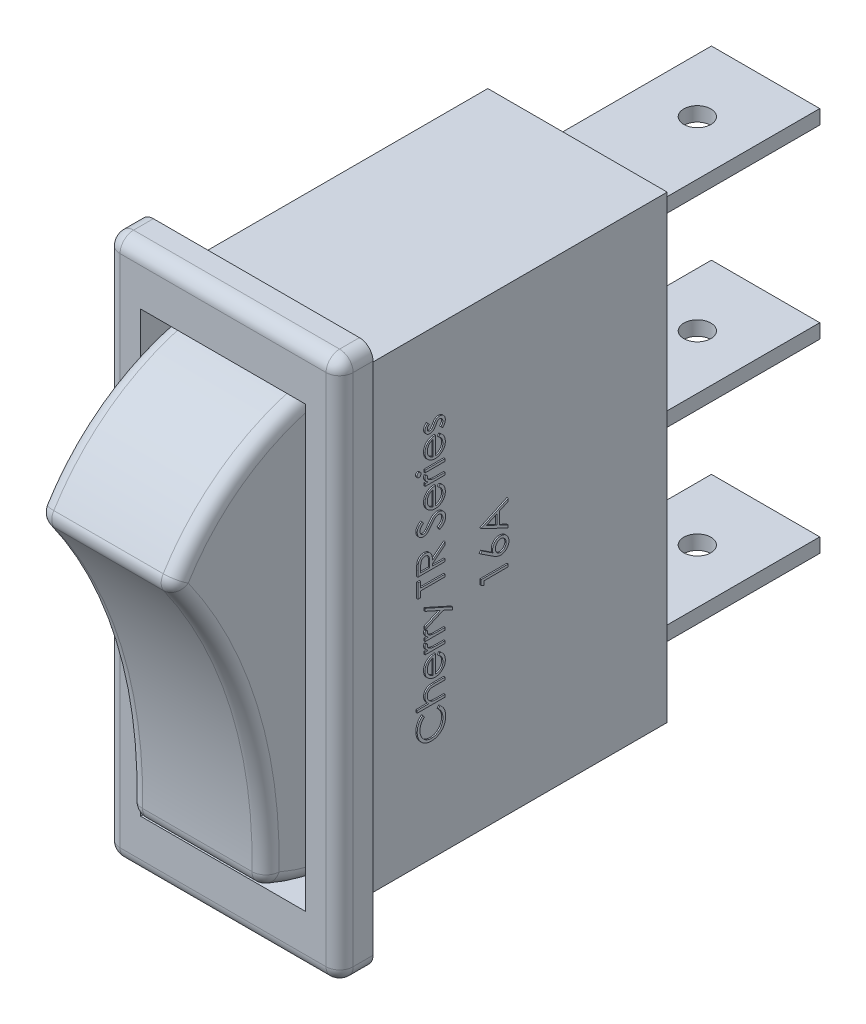
from build123d import *

# Parameters (mm, degrees)
SKETCH1_W                     = 10.5156
SKETCH1_H                     = 26.924
MAIN_BODY_DEPTH               = 18.8214
SKETCH2_W                     = 8.9281
SKETCH2_H                     = 25.3365
MAIN_BODY_LIGHT_DEPTH         = 17.4625
SKETCH3_W                     = 13.6652
SKETCH3_H                     = 31.75
SKETCH3_W_2                   = 9.6652
SKETCH3_H_2                   = 25.75
FLANGE_DEPTH                  = 1.9558
SKETCH4_R                     = 1.5875
SWITCH_BODY_AND_PROFILE_DEPTH = 4
FILLET1_R                     = 0.79375
FILLET2_R                     = 0.79375
SKETCH5_W                     = 6.35
SKETCH5_H                     = 0.8382
EXTRUDE5_DEPTH                = 11.0236
SKETCH6_W                     = 0.79375
SKETCH6_H                     = 27.0256
SKETCH8_W                     = 1.160096154
SKETCH8_H                     = 0.142467949
LABEL_TEXT_DEPTH              = 0.0762


with BuildPart() as part:
    # Sketch1 → main body (new body)
    with BuildSketch(Plane.XY):
        Rectangle(SKETCH1_W, SKETCH1_H)
    extrude(amount=-MAIN_BODY_DEPTH)

    # Sketch2 → main body light (cut)
    with BuildSketch(Plane.XY):
        Rectangle(SKETCH2_W, SKETCH2_H)
    extrude(amount=-MAIN_BODY_LIGHT_DEPTH, mode=Mode.SUBTRACT)

    # Sketch3 → flange (add)
    with BuildSketch(Plane.XY):
        Rectangle(SKETCH3_W, SKETCH3_H)
        Rectangle(SKETCH3_W_2, SKETCH3_H_2, mode=Mode.SUBTRACT)
    extrude(amount=FLANGE_DEPTH)

    # Fillet1
    fillet1_edges = [part.edges().sort_by_distance(p)[0] for p in [
        (-6.8326, 0, 1.9558),
        (0, -15.875, 1.9558),
        (6.8326, 0, 1.9558),
        (0, 15.875, 1.9558),
        (-6.8326, 15.875, 0.9779),
        (-6.8326, -15.875, 0.9779),
        (6.8326, -15.875, 0.9779),
        (6.8326, 15.875, 0.9779),
    ]]
    fillet(fillet1_edges, radius=FILLET1_R)

    # Sketch5 → Extrude5 (add)
    with BuildSketch(Plane(origin=(0, 0, -18.8214), x_dir=(-1, 0, 0), z_dir=(0, 0, -1))):
        with Locations((0, -11.0109)):
            Rectangle(SKETCH5_W, SKETCH5_H)
        with Locations((0, -0.1397)):
            Rectangle(SKETCH5_W, SKETCH5_H)
        with Locations((0, 10.7315)):
            Rectangle(SKETCH5_W, SKETCH5_H)
    extrude(amount=EXTRUDE5_DEPTH)

    # Sketch6 → 1/16 (0.0625) Diameter Hole1 (revolve, cut)
    with BuildSketch(Plane(origin=(0, 11.1506, -25.845), x_dir=(0, 0, 1), z_dir=(1, 0, 0))):
        with Locations((0.396875, 13.5128)):
            Rectangle(SKETCH6_W, SKETCH6_H)
    revolve(axis=Axis((0, 17.5006, -25.845), (0, -1, 0)), mode=Mode.SUBTRACT)

    # Sketch8 → label text (add)
    # profile 1 of 18: a face of its own
    with BuildSketch(Plane(origin=(5.2578, 0, 0), x_dir=(0, 0, -1), z_dir=(1, 0, 0))):
        with BuildLine():
            Line((4.422176487, -5.869723925), (4.517579131, -5.99438338))
            add(Edge.make_bspline(
                [(4.517579131, -5.99438338), (4.506981135, -6.003276142), (4.485928026, -6.020941772), (4.456362387, -6.049360856), (4.428672635, -6.078984828), (4.40268086, -6.109772468), (4.379431725, -6.142436275), (4.357114567, -6.175731665), (4.337575128, -6.210868407), (4.313705258, -6.259209081), (4.289340153, -6.322693504), (4.268384059, -6.402333772), (4.255169629, -6.485584911), (4.253728708, -6.542368795), (4.252995797, -6.571251369)],
                knots=[0, 0, 0, 0, 0.75789156, 1.505565099, 2.245254514, 2.979266606, 3.711207489, 4.440978832, 5.174393176, 5.91211879, 7.394186119, 8.890401545, 10.418332761, 12, 12, 12, 12], degree=3))
            add(Edge.make_bspline(
                [(4.252995797, -6.571251369), (4.253179023, -6.587164151), (4.253543774, -6.61884203), (4.258355771, -6.665854016), (4.265119069, -6.71198815), (4.275154484, -6.757214422), (4.287842064, -6.801475264), (4.303002879, -6.845060031), (4.321760247, -6.887337703), (4.342492228, -6.92889309), (4.365908886, -6.968707335), (4.39145129, -7.006378359), (4.418831979, -7.041770973), (4.448159575, -7.074905103), (4.479279951, -7.10584434), (4.512541759, -7.13419936), (4.547589419, -7.160349007), (4.584452037, -7.18414425), (4.622786294, -7.205565494), (4.662811057, -7.223577429), (4.703841019, -7.239308932), (4.746167055, -7.251952977), (4.789507843, -7.261883214), (4.834042933, -7.268748522), (4.879687888, -7.273504751), (4.91062563, -7.27386783), (4.926220457, -7.274050848)],
                knots=[0, 0, 0, 0, 1.054877232, 2.099964208, 3.13098259, 4.145888998, 5.169474743, 6.183358035, 7.203388855, 8.234598956, 9.261847606, 10.264062591, 11.251197969, 12.227332808, 13.196685059, 14.158975844, 15.123498106, 16.094582253, 17.066912473, 18.032714859, 19.002806091, 19.979168736, 20.95977404, 21.949109834, 22.966205168, 24, 24, 24, 24], degree=3))
            add(Edge.make_bspline(
                [(4.926220457, -7.274050848), (4.949683783, -7.273477181), (4.99575091, -7.272350862), (5.063236434, -7.262369418), (5.127949673, -7.247079802), (5.18945246, -7.224540004), (5.248257497, -7.196192633), (5.30365165, -7.16082293), (5.356446461, -7.119703576), (5.40536327, -7.072412738), (5.450045649, -7.020520156), (5.489393402, -6.964845574), (5.522193322, -6.905525462), (5.549487424, -6.843215373), (5.570468151, -6.777435664), (5.585238308, -6.708304667), (5.594873154, -6.635972725), (5.595795577, -6.586547319), (5.596265028, -6.561393096)],
                knots=[0, 0, 0, 0, 1.029159485, 2.020618137, 2.987588728, 3.942669054, 4.889339625, 5.846988364, 6.821327795, 7.821533711, 8.827683044, 9.822769455, 10.807800696, 11.797391277, 12.803701919, 13.832062008, 14.896664671, 16, 16, 16, 16], degree=3))
            add(Edge.make_bspline(
                [(5.596265028, -6.561393096), (5.595499046, -6.533678662), (5.59399141, -6.479130026), (5.581219179, -6.399134528), (5.560510052, -6.322555449), (5.53152778, -6.249388668), (5.493851739, -6.179840454), (5.448178058, -6.113801969), (5.394072279, -6.051217471), (5.352759574, -6.013584068), (5.331681695, -5.99438338)],
                knots=[0, 0, 0, 0, 1.028121516, 2.023589091, 2.998037872, 3.967518031, 4.937445131, 5.927275754, 6.942489185, 8, 8, 8, 8], degree=3))
            Line((5.331681695, -5.99438338), (5.426130313, -5.869723925))
            add(Edge.make_bspline(
                [(5.426130313, -5.869723925), (5.439074091, -5.879756419), (5.464899648, -5.899773353), (5.501315246, -5.932179451), (5.5355369, -5.966342572), (5.567393707, -6.002350529), (5.597017528, -6.040266789), (5.624424456, -6.080087872), (5.649469041, -6.121779787), (5.672473722, -6.165011381), (5.692728564, -6.209882271), (5.710677312, -6.25599744), (5.725536893, -6.30363964), (5.738106432, -6.352407827), (5.747069078, -6.402742449), (5.754206228, -6.454058402), (5.758440513, -6.506835987), (5.758868603, -6.542411086), (5.759085541, -6.560439069)],
                knots=[0, 0, 0, 0, 0.986911346, 1.969095443, 2.935967484, 3.900112155, 4.865124501, 5.834589912, 6.812044781, 7.795288262, 8.784678562, 9.777857908, 10.776141921, 11.791195789, 12.811324908, 13.855933174, 14.913475973, 16, 16, 16, 16], degree=3))
            add(Edge.make_bspline(
                [(5.759085541, -6.560439069), (5.758966709, -6.577513161), (5.758731732, -6.611275063), (5.754925285, -6.661121997), (5.749732012, -6.709649414), (5.741912381, -6.756718619), (5.732684769, -6.802586472), (5.720315306, -6.846837166), (5.706459077, -6.889906136), (5.690173601, -6.931620348), (5.671796618, -6.972015283), (5.651026876, -7.010960655), (5.62803903, -7.048438551), (5.603339793, -7.084817438), (5.576135803, -7.119559914), (5.546804865, -7.152967049), (5.515445838, -7.185226172), (5.492833101, -7.205184532), (5.481463846, -7.215219217)],
                knots=[0, 0, 0, 0, 1.114604814, 2.203992996, 3.262667896, 4.300477797, 5.318619304, 6.316056647, 7.298880507, 8.271930387, 9.238335007, 10.195173496, 11.151986948, 12.108099108, 13.064862484, 14.031167946, 15.010108607, 16, 16, 16, 16], degree=3))
            add(Edge.make_bspline(
                [(5.481463846, -7.215219217), (5.4617144, -7.231290765), (5.422453939, -7.263239829), (5.358830225, -7.304133699), (5.292460828, -7.33902192), (5.222961326, -7.367545221), (5.150304702, -7.389454444), (5.074607837, -7.404858051), (4.996022055, -7.414797976), (4.942575408, -7.415938872), (4.915408157, -7.416518797)],
                knots=[0, 0, 0, 0, 0.994611881, 1.977215934, 2.950189954, 3.921972279, 4.908960509, 5.911694611, 6.938501887, 8, 8, 8, 8], degree=3))
            add(Edge.make_bspline(
                [(4.915408157, -7.416518797), (4.886853362, -7.415813405), (4.830673586, -7.414425592), (4.748226114, -7.402634642), (4.669236015, -7.383666831), (4.593850745, -7.356726099), (4.521673797, -7.322569743), (4.453256536, -7.280375529), (4.388161416, -7.230633647), (4.327376154, -7.173734214), (4.271795805, -7.111337602), (4.222897991, -7.044517997), (4.182204689, -6.973406185), (4.148188573, -6.898785588), (4.122042691, -6.82009744), (4.103739639, -6.737509626), (4.092347232, -6.651177332), (4.090907049, -6.592275446), (4.090175285, -6.562347122)],
                knots=[0, 0, 0, 0, 1.032925535, 2.032216505, 3.007276963, 3.968222605, 4.92396291, 5.891752235, 6.871517503, 7.883894988, 8.900124299, 9.891468569, 10.874487609, 11.85992873, 12.854644235, 13.869047385, 14.917252991, 16, 16, 16, 16], degree=3))
            add(Edge.make_bspline(
                [(4.090175285, -6.562347122), (4.090394159, -6.544107046), (4.090827399, -6.508002654), (4.095045642, -6.454592548), (4.102092306, -6.402597252), (4.111633025, -6.351962083), (4.123647637, -6.302540651), (4.138621692, -6.254425415), (4.156449356, -6.207734198), (4.176807722, -6.162482168), (4.199700589, -6.1189748), (4.224857927, -6.077239409), (4.252152624, -6.037442382), (4.281864116, -5.999790567), (4.313745948, -5.964237897), (4.347424671, -5.930256982), (4.383764505, -5.898836974), (4.409349054, -5.879446039), (4.422176487, -5.869723925)],
                knots=[0, 0, 0, 0, 1.096622143, 2.170653093, 3.219033441, 4.250379162, 5.267604342, 6.275621678, 7.278284436, 8.271072515, 9.257558938, 10.232633088, 11.19973724, 12.157384997, 13.114417402, 14.069920322, 15.032307892, 16, 16, 16, 16], degree=3))
        make_face()
    # profile 2 of 18: a face of its own
    with BuildSketch(Plane(origin=(5.2578, 0, 0), x_dir=(0, 0, -1), z_dir=(1, 0, 0))):
        with BuildLine():
            Line((4.090175285, -5.584788027), (4.090175285, -5.442320079))
            Line((4.090175285, -5.442320079), (4.777392332, -5.442320079))
            add(Edge.make_bspline(
                [(4.777392332, -5.442320079), (4.758279168, -5.427025474), (4.72106486, -5.397246095), (4.672475427, -5.347147511), (4.630453596, -5.29556879), (4.596558126, -5.241161974), (4.570042565, -5.184401842), (4.551753667, -5.125206975), (4.540091931, -5.06381617), (4.538658066, -5.022071151), (4.537931695, -5.000923845)],
                knots=[0, 0, 0, 0, 1.125633083, 2.191665293, 3.205031882, 4.182434329, 5.134135993, 6.080017564, 7.027370072, 8, 8, 8, 8], degree=3))
            add(Edge.make_bspline(
                [(4.537931695, -5.000923845), (4.538677365, -4.979445194), (4.540137554, -4.937385221), (4.553040811, -4.876376371), (4.573341322, -4.81904747), (4.602165325, -4.766242756), (4.637763705, -4.718531561), (4.679292289, -4.676771395), (4.726757026, -4.64203445), (4.770864403, -4.618759634), (4.81010573, -4.603518873), (4.843779682, -4.593882663), (4.881299248, -4.58570875), (4.92264919, -4.578588081), (4.968026753, -4.573842013), (5.017227596, -4.570029944), (5.070248783, -4.567319188), (5.106951897, -4.56721414), (5.125929992, -4.567159822)],
                knots=[0, 0, 0, 0, 1.235771509, 2.41991536, 3.57472251, 4.727526861, 5.870395018, 6.992794988, 8.106410512, 9.245194824, 9.854018721, 10.52826073, 11.259975989, 12.064917182, 12.943387139, 13.886414983, 14.90712766, 16, 16, 16, 16], degree=3))
            Line((5.125929992, -4.567159822), (5.718380413, -4.567159822))
            Line((5.718380413, -4.567159822), (5.718380413, -4.709627771))
            Line((5.718380413, -4.709627771), (5.172677288, -4.709627771))
            add(Edge.make_bspline(
                [(5.172677288, -4.709627771), (5.1568827, -4.709713742), (5.12667034, -4.70987819), (5.083415262, -4.710428471), (5.044288033, -4.711628933), (5.009207432, -4.71364054), (4.978221, -4.715664688), (4.951278125, -4.7185344), (4.928547828, -4.721848325), (4.914866027, -4.724827928), (4.908729972, -4.726164229)],
                knots=[0, 0, 0, 0, 1.430934443, 2.737134061, 3.918973087, 4.976914145, 5.92044225, 6.731742364, 7.431207999, 8, 8, 8, 8], degree=3))
            add(Edge.make_bspline(
                [(4.908729972, -4.726164229), (4.890712642, -4.731321909), (4.856165941, -4.741211323), (4.809321781, -4.764656187), (4.76902409, -4.793258823), (4.736398166, -4.828705845), (4.710797833, -4.869760529), (4.693081668, -4.916874096), (4.682082467, -4.969570221), (4.680976233, -5.00669595), (4.680399644, -5.026046541)],
                knots=[0, 0, 0, 0, 1.090133324, 2.090238182, 3.036763777, 3.954757083, 4.878717367, 5.838952881, 6.873623762, 8, 8, 8, 8], degree=3))
            add(Edge.make_bspline(
                [(4.680399644, -5.026046541), (4.680612358, -5.0375083), (4.681033315, -5.060190825), (4.685366631, -5.093807683), (4.69221052, -5.12651887), (4.702319554, -5.158236588), (4.714610227, -5.189025538), (4.729693342, -5.219010873), (4.747930451, -5.247782226), (4.768456136, -5.275710951), (4.79116297, -5.301709848), (4.815133713, -5.325897167), (4.8406582, -5.347459288), (4.867328313, -5.366993947), (4.895509504, -5.383856961), (4.92493011, -5.398576751), (4.955628796, -5.411066156), (4.976935342, -5.417272234), (4.987596158, -5.420377471)],
                knots=[0, 0, 0, 0, 1.024369801, 2.02720137, 3.025498567, 4.008789058, 4.999724648, 5.987391013, 7.005161842, 8.042127274, 9.083588116, 10.088924978, 11.084112559, 12.068088063, 13.041783903, 14.016724555, 15.007660144, 16, 16, 16, 16], degree=3))
            add(Edge.make_bspline(
                [(4.987596158, -5.420377471), (4.995316375, -5.422164282), (5.012139678, -5.426057965), (5.039886604, -5.430282907), (5.072129351, -5.434064693), (5.108819016, -5.437261714), (5.150090044, -5.439222543), (5.1956608, -5.441335387), (5.245816738, -5.442121887), (5.280694343, -5.44225204), (5.298926787, -5.442320079)],
                knots=[0, 0, 0, 0, 0.607992626, 1.324890765, 2.152360218, 3.099583803, 4.150613268, 5.323148443, 6.60066238, 8, 8, 8, 8], degree=3))
            Line((5.298926787, -5.442320079), (5.718380413, -5.442320079))
            Line((5.718380413, -5.442320079), (5.718380413, -5.584788027))
            Line((5.718380413, -5.584788027), (4.090175285, -5.584788027))
        make_face()
    # profile 3 of 18: a face of its own
    with BuildSketch(Plane(origin=(5.2578, 0, 0), x_dir=(0, 0, -1), z_dir=(1, 0, 0))):
        with BuildLine():
            Line((5.352034259, -3.289400407), (5.418498101, -3.162832899))
            add(Edge.make_bspline(
                [(5.418498101, -3.162832899), (5.436384228, -3.172924075), (5.471183549, -3.192557506), (5.518996313, -3.226183896), (5.561753374, -3.261756808), (5.598770066, -3.300358584), (5.631460403, -3.34082599), (5.659657646, -3.383927626), (5.683870576, -3.429311682), (5.703710813, -3.47747804), (5.719308353, -3.528369), (5.730827244, -3.58227987), (5.737507105, -3.639465195), (5.73831784, -3.678625628), (5.738732977, -3.698677751)],
                knots=[0, 0, 0, 0, 1.120611642, 2.180266485, 3.186550691, 4.152466804, 5.095166165, 6.022949561, 6.960161436, 7.899497276, 8.862391909, 9.862399089, 10.905440174, 12, 12, 12, 12], degree=3))
            add(Edge.make_bspline(
                [(5.738732977, -3.698677751), (5.738212651, -3.720967148), (5.737197646, -3.764447304), (5.728447135, -3.827738547), (5.714172172, -3.887328496), (5.694230661, -3.943213811), (5.668183258, -3.995257594), (5.636451672, -4.043563428), (5.599198692, -4.088384805), (5.556102464, -4.128311348), (5.509980517, -4.164249371), (5.461928883, -4.195982852), (5.412113972, -4.222389658), (5.360832171, -4.24419827), (5.308200013, -4.261401132), (5.253916067, -4.273625751), (5.198195584, -4.280607644), (5.16050579, -4.281682342), (5.141512424, -4.282223925)],
                knots=[0, 0, 0, 0, 1.14524686, 2.234044844, 3.276713788, 4.290115724, 5.276966211, 6.260758605, 7.254862358, 8.264742877, 9.274005885, 10.257798278, 11.220590477, 12.167824544, 13.118936889, 14.062732937, 15.023735098, 16, 16, 16, 16], degree=3))
            add(Edge.make_bspline(
                [(5.141512424, -4.282223925), (5.123689412, -4.281743529), (5.088366555, -4.280791447), (5.036085397, -4.27479034), (4.985272492, -4.264154864), (4.935885617, -4.249560603), (4.888007464, -4.230714145), (4.841608892, -4.207658102), (4.796739275, -4.180356559), (4.768434996, -4.159277882), (4.754177688, -4.148660223)],
                knots=[0, 0, 0, 0, 1.024358464, 2.0301432, 3.019427413, 4.004406732, 4.986367066, 5.972626655, 6.978780325, 8, 8, 8, 8], degree=3))
            add(Edge.make_bspline(
                [(4.754177688, -4.148660223), (4.736972972, -4.134303318), (4.703163804, -4.106090414), (4.659144777, -4.057877241), (4.621490262, -4.006374305), (4.590771635, -3.951063549), (4.567144153, -3.89203814), (4.550338238, -3.829602528), (4.53988083, -3.763584142), (4.538591285, -3.718327815), (4.537931695, -3.695179654)],
                knots=[0, 0, 0, 0, 1.030811313, 2.025658015, 2.997072178, 3.962767568, 4.930766827, 5.917075773, 6.934604948, 8, 8, 8, 8], degree=3))
            add(Edge.make_bspline(
                [(4.537931695, -3.695179654), (4.538542777, -3.671389551), (4.53974158, -3.624718792), (4.550954842, -3.556687835), (4.56852109, -3.492189113), (4.594114279, -3.431754901), (4.625838786, -3.374453998), (4.665937076, -3.321605176), (4.712349656, -3.271757701), (4.748080111, -3.242773631), (4.766262023, -3.228024706)],
                knots=[0, 0, 0, 0, 1.056389096, 2.072394598, 3.055233004, 4.020130009, 4.981825462, 5.957811105, 6.960805292, 8, 8, 8, 8], degree=3))
            add(Edge.make_bspline(
                [(4.766262023, -3.228024706), (4.779961505, -3.217988559), (4.80726928, -3.197983069), (4.851796912, -3.172924563), (4.898383503, -3.151172458), (4.947782102, -3.133785723), (4.999407412, -3.119707092), (5.053628495, -3.10952132), (5.110429204, -3.103547958), (5.149130892, -3.102373798), (5.168861182, -3.101775207)],
                knots=[0, 0, 0, 0, 0.94817472, 1.890038105, 2.849395472, 3.817997239, 4.812318967, 5.836947057, 6.897266129, 8, 8, 8, 8], degree=3))
            Line((5.168861182, -3.101775207), (5.168861182, -4.139755976))
            add(Edge.make_bspline(
                [(5.168861182, -4.139755976), (5.18414675, -4.139057655), (5.214205202, -4.137684434), (5.258188379, -4.131282208), (5.300086288, -4.1211908), (5.339584667, -4.107008047), (5.377199404, -4.089832727), (5.41265147, -4.068793492), (5.445779389, -4.043693051), (5.476879483, -4.015696037), (5.5045749, -3.984532462), (5.529363384, -3.951747073), (5.550139494, -3.916870349), (5.56700323, -3.88017729), (5.580205023, -3.84172723), (5.589216499, -3.801508056), (5.595252223, -3.75959891), (5.595923356, -3.731030381), (5.596265028, -3.716486245)],
                knots=[0, 0, 0, 0, 1.094153842, 2.151609401, 3.174256925, 4.172055639, 5.149267565, 6.128595816, 7.11444997, 8.118368179, 9.117203808, 10.09244225, 11.054858984, 12.015122123, 12.976791628, 13.957293641, 14.960065497, 16, 16, 16, 16], degree=3))
            add(Edge.make_bspline(
                [(5.596265028, -3.716486245), (5.595991452, -3.702265639), (5.595448624, -3.674049231), (5.590094649, -3.632039124), (5.581609063, -3.590636752), (5.569387239, -3.550253229), (5.555075647, -3.511477093), (5.538230996, -3.475369896), (5.519026187, -3.442408993), (5.497202328, -3.411482527), (5.47041872, -3.381647775), (5.437316523, -3.351583015), (5.397520288, -3.320057204), (5.36776683, -3.300003888), (5.352034259, -3.289400407)],
                knots=[0, 0, 0, 0, 0.991168677, 1.966668791, 2.94808785, 3.9350306, 4.905702032, 5.828266021, 6.709360349, 7.562606342, 8.463112863, 9.498839253, 10.677475166, 12, 12, 12, 12], degree=3))
        make_face()
        with BuildLine():
            add(Edge.make_bspline(
                [(5.026393233, -3.244243156), (5.007486701, -3.249436579), (4.971192301, -3.259406266), (4.920950892, -3.280638445), (4.876041979, -3.303973811), (4.837211849, -3.332064999), (4.802670285, -3.363582234), (4.772967446, -3.400489678), (4.745590909, -3.441186614), (4.722792771, -3.486483641), (4.704058189, -3.534594471), (4.69028248, -3.584530236), (4.682184706, -3.635872679), (4.680997461, -3.670453059), (4.680399644, -3.687865451)],
                knots=[0, 0, 0, 0, 1.155085888, 2.217389643, 3.210301801, 4.133263417, 5.03575695, 5.95948047, 6.920061569, 7.923798377, 8.943125483, 9.960783337, 10.973185325, 12, 12, 12, 12], degree=3))
            add(Edge.make_bspline(
                [(4.680399644, -3.687865451), (4.680673845, -3.702085748), (4.681215884, -3.730196283), (4.68646515, -3.77159214), (4.694900138, -3.81144988), (4.707302489, -3.849650531), (4.722393699, -3.88644749), (4.74094385, -3.921814169), (4.763371307, -3.955295923), (4.780503524, -3.976221972), (4.789158658, -3.986793737)],
                knots=[0, 0, 0, 0, 1.048823158, 2.073302879, 3.073550078, 4.050623576, 5.03253758, 6.005186856, 6.992227572, 8, 8, 8, 8], degree=3))
            add(Edge.make_bspline(
                [(4.789158658, -3.986793737), (4.796004289, -3.994366519), (4.809858177, -4.009691985), (4.833740513, -4.030147915), (4.859508155, -4.049879809), (4.888285884, -4.067414473), (4.919239178, -4.084078568), (4.952593895, -4.099263879), (4.988490827, -4.113071067), (5.013517407, -4.120821878), (5.026393233, -4.124809562)],
                knots=[0, 0, 0, 0, 0.879905587, 1.780714457, 2.708106151, 3.677566983, 4.684151534, 5.740052498, 6.837288539, 8, 8, 8, 8], degree=3))
            Line((5.026393233, -4.124809562), (5.026393233, -3.244243156))
        make_face(mode=Mode.SUBTRACT)
    # profile 4 of 18: a face of its own
    with BuildSketch(Plane(origin=(5.2578, 0, 0), x_dir=(0, 0, -1), z_dir=(1, 0, 0))):
        with BuildLine():
            Line((4.558284259, -2.857544438), (4.558284259, -2.715076489))
            Line((4.558284259, -2.715076489), (4.729054992, -2.715076489))
            add(Edge.make_bspline(
                [(4.729054992, -2.715076489), (4.713147552, -2.70456546), (4.682724696, -2.6844632), (4.642542522, -2.650894461), (4.608893349, -2.616876797), (4.58241887, -2.581516966), (4.562410629, -2.545161645), (4.548351465, -2.508117397), (4.53963295, -2.470293637), (4.53849954, -2.444814052), (4.537931695, -2.432048644)],
                knots=[0, 0, 0, 0, 1.280091057, 2.448164201, 3.510831157, 4.48793739, 5.405868014, 6.289422536, 7.142991551, 8, 8, 8, 8], degree=3))
            add(Edge.make_bspline(
                [(4.537931695, -2.432048644), (4.538471684, -2.422148846), (4.539582746, -2.401779368), (4.547389084, -2.370944408), (4.55985233, -2.3391747), (4.571572717, -2.318699402), (4.577682797, -2.308025207)],
                knots=[0, 0, 0, 0, 0.901110191, 1.854092781, 2.881294221, 4, 4, 4, 4], degree=3))
            Line((4.577682797, -2.308025207), (4.701070217, -2.386255375))
            add(Edge.make_bspline(
                [(4.701070217, -2.386255375), (4.698013024, -2.393108396), (4.692209888, -2.40611674), (4.685341905, -2.425146133), (4.681297901, -2.442690882), (4.680685254, -2.453868496), (4.680399644, -2.459079394)],
                knots=[0, 0, 0, 0, 1.180555205, 2.24091978, 3.179933427, 4, 4, 4, 4], degree=3))
            add(Edge.make_bspline(
                [(4.680399644, -2.459079394), (4.681155693, -2.470515427), (4.682697815, -2.493841619), (4.694994438, -2.527973474), (4.714290645, -2.561390519), (4.73626332, -2.587674182), (4.757369995, -2.608097082), (4.775842991, -2.622784712), (4.796748463, -2.63596708), (4.819278368, -2.648754326), (4.843998144, -2.660634644), (4.870948116, -2.671251452), (4.899905742, -2.681180212), (4.920040655, -2.686771633), (4.930354571, -2.689635784)],
                knots=[0, 0, 0, 0, 1.125322384, 2.295331465, 3.535939348, 4.916963136, 5.656144286, 6.429838446, 7.238666481, 8.090384391, 8.983239461, 9.940052224, 10.944811494, 12, 12, 12, 12], degree=3))
            add(Edge.make_bspline(
                [(4.930354571, -2.689635784), (4.939551209, -2.691785972), (4.960023211, -2.696572358), (4.994212246, -2.7011019), (5.03457948, -2.705757531), (5.081171809, -2.708936859), (5.134168334, -2.711940157), (5.193340427, -2.713599303), (5.258850726, -2.715023701), (5.304543901, -2.715058332), (5.328501607, -2.715076489)],
                knots=[0, 0, 0, 0, 0.566841273, 1.261806378, 2.068780918, 3.007109044, 4.065315289, 5.256255371, 6.561408263, 8, 8, 8, 8], degree=3))
            Line((5.328501607, -2.715076489), (5.718380413, -2.715076489))
            Line((5.718380413, -2.715076489), (5.718380413, -2.857544438))
            Line((5.718380413, -2.857544438), (4.558284259, -2.857544438))
        make_face()
    # profile 5 of 18: a face of its own
    with BuildSketch(Plane(origin=(5.2578, 0, 0), x_dir=(0, 0, -1), z_dir=(1, 0, 0))):
        with BuildLine():
            Line((4.558284259, -2.185909822), (4.558284259, -2.043441874))
            Line((4.558284259, -2.043441874), (4.729054992, -2.043441874))
            add(Edge.make_bspline(
                [(4.729054992, -2.043441874), (4.713147552, -2.032930845), (4.682724696, -2.012828584), (4.642542522, -1.979259845), (4.608893349, -1.945242181), (4.58241887, -1.909882351), (4.562410629, -1.873527029), (4.548351465, -1.836482782), (4.53963295, -1.798659022), (4.53849954, -1.773179437), (4.537931695, -1.760414029)],
                knots=[0, 0, 0, 0, 1.280091057, 2.448164201, 3.510831157, 4.48793739, 5.405868014, 6.289422536, 7.142991551, 8, 8, 8, 8], degree=3))
            add(Edge.make_bspline(
                [(4.537931695, -1.760414029), (4.538471684, -1.750514231), (4.539582746, -1.730144753), (4.547389084, -1.699309793), (4.55985233, -1.667540084), (4.571572717, -1.647064787), (4.577682797, -1.636390592)],
                knots=[0, 0, 0, 0, 0.901110191, 1.854092781, 2.881294221, 4, 4, 4, 4], degree=3))
            Line((4.577682797, -1.636390592), (4.701070217, -1.71462076))
            add(Edge.make_bspline(
                [(4.701070217, -1.71462076), (4.698013024, -1.72147378), (4.692209888, -1.734482125), (4.685341905, -1.753511517), (4.681297901, -1.771056266), (4.680685254, -1.78223388), (4.680399644, -1.787444778)],
                knots=[0, 0, 0, 0, 1.180555205, 2.24091978, 3.179933427, 4, 4, 4, 4], degree=3))
            add(Edge.make_bspline(
                [(4.680399644, -1.787444778), (4.681155693, -1.798880811), (4.682697815, -1.822207004), (4.694994438, -1.856338859), (4.714290645, -1.889755904), (4.73626332, -1.916039567), (4.757369995, -1.936462466), (4.775842991, -1.951150097), (4.796748463, -1.964332464), (4.819278368, -1.977119711), (4.843998144, -1.989000028), (4.870948116, -1.999616837), (4.899905742, -2.009545597), (4.920040655, -2.015137017), (4.930354571, -2.018001169)],
                knots=[0, 0, 0, 0, 1.125322384, 2.295331465, 3.535939348, 4.916963136, 5.656144286, 6.429838446, 7.238666481, 8.090384391, 8.983239461, 9.940052224, 10.944811494, 12, 12, 12, 12], degree=3))
            add(Edge.make_bspline(
                [(4.930354571, -2.018001169), (4.939551209, -2.020151357), (4.960023211, -2.024937742), (4.994212246, -2.029467285), (5.03457948, -2.034122916), (5.081171809, -2.037302243), (5.134168334, -2.040305542), (5.193340427, -2.041964688), (5.258850726, -2.043389085), (5.304543901, -2.043423716), (5.328501607, -2.043441874)],
                knots=[0, 0, 0, 0, 0.566841273, 1.261806378, 2.068780918, 3.007109044, 4.065315289, 5.256255371, 6.561408263, 8, 8, 8, 8], degree=3))
            Line((5.328501607, -2.043441874), (5.718380413, -2.043441874))
            Line((5.718380413, -2.043441874), (5.718380413, -2.185909822))
            Line((5.718380413, -2.185909822), (4.558284259, -2.185909822))
        make_face()
    # profile 6 of 18: a face of its own
    with BuildSketch(Plane(origin=(5.2578, 0, 0), x_dir=(0, 0, -1), z_dir=(1, 0, 0))):
        Polygon((4.558284259, -1.595685463), (4.558284259, -1.442087206), (5.446800886, -1.049346321), (4.558284259, -0.650563268), (4.558284259, -0.496647002), (6.145784259, -1.208986745), (6.145784259, -1.362903011), (5.619479672, -1.126622463), align=None)
    # profile 7 of 18: a face of its own
    with BuildSketch(Plane(origin=(5.2578, 0, 0), x_dir=(0, 0, -1), z_dir=(1, 0, 0))):
        Polygon((4.293700926, 0.174987614), (4.130880413, 0.174987614), (4.130880413, 1.009442742), (4.293700926, 1.009442742), (4.293700926, 0.663449152), (5.718380413, 0.663449152), (5.718380413, 0.520981203), (4.293700926, 0.520981203), align=None)
    # profile 8 of 18: a face of its own
    with BuildSketch(Plane(origin=(5.2578, 0, 0), x_dir=(0, 0, -1), z_dir=(1, 0, 0))):
        with BuildLine():
            Line((4.130880413, 1.294378639), (4.130880413, 1.612069444))
            add(Edge.make_bspline(
                [(4.130880413, 1.612069444), (4.130950982, 1.633269885), (4.131086483, 1.673977079), (4.131842026, 1.732294241), (4.134007537, 1.785283674), (4.135871073, 1.832917673), (4.139269204, 1.875195363), (4.142517069, 1.912246384), (4.146768693, 1.943900089), (4.150717224, 1.963061601), (4.152505012, 1.971737413)],
                knots=[0, 0, 0, 0, 1.410062039, 2.707475311, 3.878576406, 4.937260626, 5.877586885, 6.699081471, 7.410979367, 8, 8, 8, 8], degree=3))
            add(Edge.make_bspline(
                [(4.152505012, 1.971737413), (4.15537466, 1.983351837), (4.161052738, 2.006332918), (4.173053945, 2.039421115), (4.186942545, 2.070950343), (4.203253153, 2.10079249), (4.222115886, 2.128787536), (4.243171528, 2.155263561), (4.266377552, 2.180134622), (4.291943153, 2.203076131), (4.319323618, 2.223915076), (4.348443801, 2.242194041), (4.379183295, 2.257639431), (4.41158998, 2.269760097), (4.445305875, 2.279930668), (4.480675102, 2.286764038), (4.517579586, 2.29102056), (4.542689904, 2.291441063), (4.55542218, 2.29165428)],
                knots=[0, 0, 0, 0, 1.02737844, 2.032840108, 3.019645024, 3.985760442, 4.950801802, 5.916702504, 6.889791722, 7.870143693, 8.864820395, 9.842884691, 10.820524757, 11.815201459, 12.812418953, 13.84314332, 14.906358105, 16, 16, 16, 16], degree=3))
            add(Edge.make_bspline(
                [(4.55542218, 2.29165428), (4.576574531, 2.290987985), (4.617848246, 2.289687869), (4.677747289, 2.277566126), (4.733622442, 2.257710347), (4.785403353, 2.230349427), (4.832080681, 2.195506308), (4.873079209, 2.15363042), (4.907387313, 2.104698404), (4.931178406, 2.059146535), (4.94641519, 2.018908309), (4.957135967, 1.985782485), (4.965419072, 1.94964782), (4.972839561, 1.910850529), (4.978441936, 1.869229157), (4.982545213, 1.82488346), (4.985109728, 1.777781813), (4.985491637, 1.745424449), (4.985688105, 1.728778679)],
                knots=[0, 0, 0, 0, 1.260483769, 2.459530307, 3.627416485, 4.787058657, 5.939039949, 7.08810263, 8.267026773, 9.491475466, 10.141966685, 10.831826277, 11.566392101, 12.351337768, 13.187381173, 14.07005841, 15.007169909, 16, 16, 16, 16], degree=3))
            Line((4.985688105, 1.728778679), (5.718380413, 2.312006844))
            Line((5.718380413, 2.312006844), (5.718380413, 2.135829961))
            Line((5.718380413, 2.135829961), (4.985688105, 1.552601796))
            Line((4.985688105, 1.552601796), (4.985688105, 1.436846588))
            Line((4.985688105, 1.436846588), (5.718380413, 1.436846588))
            Line((5.718380413, 1.436846588), (5.718380413, 1.294378639))
            Line((5.718380413, 1.294378639), (4.130880413, 1.294378639))
        make_face()
        with BuildLine():
            Line((4.293700926, 1.436846588), (4.822867592, 1.436846588))
            Line((4.822867592, 1.436846588), (4.825093654, 1.727506644))
            add(Edge.make_bspline(
                [(4.825093654, 1.727506644), (4.825099661, 1.741077521), (4.825111305, 1.767381745), (4.823299795, 1.805436665), (4.821239236, 1.840869797), (4.818086675, 1.873545152), (4.81402622, 1.903478845), (4.808939117, 1.930650946), (4.803037811, 1.955122019), (4.793809321, 1.983569938), (4.779826971, 2.015711996), (4.758109869, 2.049879693), (4.732015174, 2.079859105), (4.701314554, 2.10427511), (4.668095547, 2.124731744), (4.63201793, 2.138498245), (4.594252024, 2.147673033), (4.568303906, 2.148676083), (4.555104171, 2.149186331)],
                knots=[0, 0, 0, 0, 1.146477201, 2.22219935, 3.21835465, 4.145220026, 4.995151787, 5.769831222, 6.480173269, 7.120302478, 8.295254187, 9.430763426, 10.528629691, 11.636497428, 12.733230534, 13.811001502, 14.886462612, 16, 16, 16, 16], degree=3))
            add(Edge.make_bspline(
                [(4.555104171, 2.149186331), (4.54233873, 2.14863951), (4.517042285, 2.147555909), (4.479990236, 2.138757575), (4.445009662, 2.123715943), (4.4120554, 2.103928609), (4.382608951, 2.07909542), (4.357140575, 2.050536508), (4.336291204, 2.018257367), (4.322433956, 1.988353851), (4.314296206, 1.961411381), (4.308381433, 1.938129997), (4.304276361, 1.911694912), (4.300388109, 1.882226344), (4.297240464, 1.849668055), (4.295069262, 1.813924619), (4.293797708, 1.775217454), (4.293733937, 1.748390217), (4.293700926, 1.734502838)],
                knots=[0, 0, 0, 0, 1.100823979, 2.181431445, 3.263702604, 4.376021382, 5.48638238, 6.575013887, 7.666064109, 8.791843368, 9.405226397, 10.093019944, 10.863016055, 11.711746407, 12.658404307, 13.684961631, 14.801597923, 16, 16, 16, 16], degree=3))
            Line((4.293700926, 1.734502838), (4.293700926, 1.436846588))
        make_face(mode=Mode.SUBTRACT)
    # profile 9 of 18: a face of its own
    with BuildSketch(Plane(origin=(5.2578, 0, 0), x_dir=(0, 0, -1), z_dir=(1, 0, 0))):
        with BuildLine():
            Line((5.412137925, 3.08540428), (5.331681695, 3.219604))
            add(Edge.make_bspline(
                [(5.331681695, 3.219604), (5.352575184, 3.232085486), (5.392606302, 3.255999532), (5.446698342, 3.295891755), (5.49267332, 3.33722704), (5.530263781, 3.380311488), (5.559858812, 3.424882114), (5.580814824, 3.471229882), (5.593884928, 3.519198603), (5.595472467, 3.551843872), (5.596265028, 3.56814166)],
                knots=[0, 0, 0, 0, 1.272034388, 2.437168799, 3.508375237, 4.49857839, 5.41946034, 6.295179144, 7.148887113, 8, 8, 8, 8], degree=3))
            add(Edge.make_bspline(
                [(5.596265028, 3.56814166), (5.595868151, 3.582057525), (5.59508134, 3.609645761), (5.587826555, 3.65033969), (5.575957742, 3.689663884), (5.559868281, 3.727227436), (5.540090836, 3.762035157), (5.516769516, 3.793047606), (5.489822565, 3.819234331), (5.460248241, 3.840943444), (5.428534648, 3.857741797), (5.395858294, 3.870438155), (5.361770837, 3.8775488), (5.338814458, 3.878615814), (5.327229571, 3.87915428)],
                knots=[0, 0, 0, 0, 1.09553864, 2.171907928, 3.244545276, 4.325730702, 5.384330216, 6.391480148, 7.371786628, 8.333890167, 9.27165687, 10.191402356, 11.087295184, 12, 12, 12, 12], degree=3))
            add(Edge.make_bspline(
                [(5.327229571, 3.87915428), (5.314007703, 3.878499937), (5.287231978, 3.877174822), (5.247659949, 3.865496489), (5.208329745, 3.847664165), (5.183996897, 3.830903784), (5.171405253, 3.822230702)],
                knots=[0, 0, 0, 0, 0.938992559, 1.901562324, 2.914110574, 4, 4, 4, 4], degree=3))
            add(Edge.make_bspline(
                [(5.171405253, 3.822230702), (5.162311437, 3.815124002), (5.143220107, 3.800204372), (5.114826204, 3.774533204), (5.08547857, 3.744563197), (5.054532922, 3.710704538), (5.022246289, 3.67290043), (4.988366725, 3.631136249), (4.953586561, 3.58505556), (4.93029058, 3.552711679), (4.918270237, 3.53602277)],
                knots=[0, 0, 0, 0, 0.72225051, 1.516274602, 2.393638633, 3.3469932, 4.386926276, 5.505032946, 6.712638081, 8, 8, 8, 8], degree=3))
            add(Edge.make_bspline(
                [(4.918270237, 3.53602277), (4.906373699, 3.519320457), (4.883628424, 3.487386907), (4.849871695, 3.442728908), (4.81900894, 3.402794455), (4.79074962, 3.367761044), (4.765089903, 3.337644084), (4.742276195, 3.312206251), (4.721691508, 3.292095548), (4.708337757, 3.280912481), (4.702342252, 3.27589156)],
                knots=[0, 0, 0, 0, 1.452282411, 2.77665338, 3.964542531, 5.026858415, 5.96415736, 6.766646006, 7.446254459, 8, 8, 8, 8], degree=3))
            add(Edge.make_bspline(
                [(4.702342252, 3.27589156), (4.692997746, 3.268874832), (4.674620522, 3.255075494), (4.645904786, 3.23684058), (4.616565479, 3.221463027), (4.586496269, 3.209086972), (4.555923145, 3.199078925), (4.524616576, 3.192120765), (4.492789089, 3.187831902), (4.471375135, 3.187388875), (4.460655553, 3.187167101)],
                knots=[0, 0, 0, 0, 1.068019517, 2.100403715, 3.106014851, 4.09224787, 5.069873182, 6.043214339, 7.020455327, 8, 8, 8, 8], degree=3))
            add(Edge.make_bspline(
                [(4.460655553, 3.187167101), (4.443859872, 3.18775908), (4.410627507, 3.188930385), (4.362081857, 3.198837002), (4.315731242, 3.214471497), (4.272045224, 3.23638203), (4.232121425, 3.264600168), (4.195600493, 3.297397567), (4.164479346, 3.336099391), (4.13771189, 3.378945187), (4.116544062, 3.425596868), (4.101203663, 3.474710943), (4.092091659, 3.525934365), (4.090820353, 3.560685182), (4.090175285, 3.578317942)],
                knots=[0, 0, 0, 0, 1.005248779, 1.989011071, 2.95484373, 3.928844559, 4.904706341, 5.875556129, 6.859318422, 7.868909462, 8.894684146, 9.918924798, 10.944050749, 12, 12, 12, 12], degree=3))
            add(Edge.make_bspline(
                [(4.090175285, 3.578317942), (4.090811752, 3.597028117), (4.092077483, 3.634236682), (4.103356571, 3.688881026), (4.121307751, 3.741707408), (4.142369187, 3.784014392), (4.163270636, 3.817196045), (4.182349941, 3.842475892), (4.204269366, 3.868232483), (4.229491005, 3.894189011), (4.257510402, 3.920601721), (4.288564742, 3.947348951), (4.322374175, 3.974681007), (4.34651632, 3.99225857), (4.358892733, 4.001269665)],
                knots=[0, 0, 0, 0, 1.286507425, 2.558452658, 3.822738219, 5.118007103, 5.800084425, 6.519418873, 7.295692132, 8.12638276, 9.008892966, 9.945018126, 10.946518512, 12, 12, 12, 12], degree=3))
            Line((4.358892733, 4.001269665), (4.456521438, 3.872476095))
            add(Edge.make_bspline(
                [(4.456521438, 3.872476095), (4.44650206, 3.864699757), (4.427207079, 3.849724348), (4.400194945, 3.826979503), (4.375487049, 3.805574424), (4.354082759, 3.784323861), (4.334379239, 3.764865804), (4.317809216, 3.745645181), (4.303849158, 3.72740372), (4.288923998, 3.704465586), (4.274576709, 3.675408226), (4.261974301, 3.639236488), (4.254497881, 3.601307789), (4.253500641, 3.575488361), (4.252995797, 3.562417501)],
                knots=[0, 0, 0, 0, 1.181392137, 2.275085037, 3.289537922, 4.225335853, 5.084247276, 5.86831218, 6.587234301, 7.222706459, 8.415108401, 9.595592188, 10.782789524, 12, 12, 12, 12], degree=3))
            add(Edge.make_bspline(
                [(4.252995797, 3.562417501), (4.253536391, 3.546014066), (4.254578874, 3.514381585), (4.26626395, 3.46957735), (4.284030322, 3.429018337), (4.309649245, 3.394252878), (4.340191935, 3.365547578), (4.375023723, 3.344525587), (4.413494077, 3.331956908), (4.440316923, 3.330418524), (4.453977368, 3.329635049)],
                knots=[0, 0, 0, 0, 1.144248881, 2.206576175, 3.214949548, 4.222996039, 5.203671638, 6.127710127, 7.046472867, 8, 8, 8, 8], degree=3))
            add(Edge.make_bspline(
                [(4.453977368, 3.329635049), (4.462480553, 3.329823547), (4.479605374, 3.330203168), (4.504785442, 3.335054106), (4.529832743, 3.341612973), (4.554659124, 3.351668031), (4.579826762, 3.365670532), (4.605691129, 3.384038814), (4.632475006, 3.407178144), (4.649895537, 3.424902188), (4.659093053, 3.434259949)],
                knots=[0, 0, 0, 0, 0.858259122, 1.72847414, 2.583651051, 3.473048463, 4.427392529, 5.488649985, 6.674082839, 8, 8, 8, 8], degree=3))
            add(Edge.make_bspline(
                [(4.659093053, 3.434259949), (4.662194133, 3.437734929), (4.669561588, 3.445990685), (4.681623087, 3.461083694), (4.696501487, 3.481014892), (4.714910734, 3.505263819), (4.73626554, 3.534277587), (4.760292857, 3.568059385), (4.78777269, 3.606232652), (4.80698486, 3.633320807), (4.817143434, 3.647643864)],
                knots=[0, 0, 0, 0, 0.420754252, 0.999615792, 1.744751191, 2.668019286, 3.750313428, 4.999500688, 6.413464383, 8, 8, 8, 8], degree=3))
            add(Edge.make_bspline(
                [(4.817143434, 3.647643864), (4.829680773, 3.664873176), (4.853957594, 3.698235353), (4.890431729, 3.745705205), (4.92610452, 3.788745762), (4.960745843, 3.827511321), (4.994100674, 3.862374191), (5.026544444, 3.892982936), (5.05786439, 3.919476434), (5.097745454, 3.948388098), (5.147179492, 3.977580309), (5.207772813, 4.00261023), (5.268540019, 4.018533837), (5.309330107, 4.020601875), (5.329455633, 4.021622229)],
                knots=[0, 0, 0, 0, 1.163604038, 2.253157948, 3.268574773, 4.215621239, 5.091738613, 5.902582348, 6.650434646, 7.330118262, 8.591011492, 9.77460283, 10.902005569, 12, 12, 12, 12], degree=3))
            add(Edge.make_bspline(
                [(5.329455633, 4.021622229), (5.343687812, 4.021323866), (5.371875791, 4.020732934), (5.413268679, 4.013951509), (5.453460956, 4.003992946), (5.491916062, 3.989104066), (5.52925102, 3.970635304), (5.564762512, 3.947536201), (5.599140451, 3.920621374), (5.631421043, 3.8897627), (5.661091066, 3.856013506), (5.687374853, 3.820214542), (5.709795134, 3.782739515), (5.727650689, 3.743182598), (5.741709809, 3.701968735), (5.751867821, 3.65896202), (5.758109141, 3.614118886), (5.758756441, 3.583638495), (5.759085541, 3.56814166)],
                knots=[0, 0, 0, 0, 0.983922938, 1.948738757, 2.895227473, 3.844781104, 4.796118043, 5.772795661, 6.770647148, 7.813532943, 8.8582745, 9.876489951, 10.882905461, 11.874265028, 12.874055871, 13.891769171, 14.928133632, 16, 16, 16, 16], degree=3))
            add(Edge.make_bspline(
                [(5.759085541, 3.56814166), (5.758853684, 3.556151344), (5.758392889, 3.532321717), (5.754319237, 3.497074916), (5.748555656, 3.462540175), (5.73940528, 3.429150834), (5.728303202, 3.396476746), (5.714633393, 3.364659874), (5.698251369, 3.333685347), (5.679522253, 3.303377479), (5.657720248, 3.273821477), (5.632349751, 3.24526251), (5.604057705, 3.216949273), (5.572407044, 3.18908261), (5.53704972, 3.162270484), (5.498512396, 3.135869221), (5.456680471, 3.110007487), (5.427262761, 3.093758528), (5.412137925, 3.08540428)],
                knots=[0, 0, 0, 0, 0.915313873, 1.819100311, 2.706792138, 3.586475221, 4.459428225, 5.3405999, 6.2277379, 7.133009489, 8.059106158, 9.028520402, 10.047404263, 11.114294124, 12.246039232, 13.433834781, 14.680630578, 16, 16, 16, 16], degree=3))
        make_face()
    # profile 10 of 18: a face of its own
    with BuildSketch(Plane(origin=(5.2578, 0, 0), x_dir=(0, 0, -1), z_dir=(1, 0, 0))):
        with BuildLine():
            Line((5.352034259, 5.258676516), (5.418498101, 5.385244024))
            add(Edge.make_bspline(
                [(5.418498101, 5.385244024), (5.436384228, 5.375152848), (5.471183549, 5.355519417), (5.518996313, 5.321893027), (5.561753374, 5.286320115), (5.598770066, 5.247718339), (5.631460403, 5.207250934), (5.659657646, 5.164149297), (5.683870576, 5.118765241), (5.703710813, 5.070598883), (5.719308353, 5.019707923), (5.730827244, 4.965797053), (5.737507105, 4.908611728), (5.73831784, 4.869451295), (5.738732977, 4.849399172)],
                knots=[0, 0, 0, 0, 1.120611642, 2.180266485, 3.186550691, 4.152466804, 5.095166165, 6.022949561, 6.960161436, 7.899497276, 8.862391909, 9.862399089, 10.905440174, 12, 12, 12, 12], degree=3))
            add(Edge.make_bspline(
                [(5.738732977, 4.849399172), (5.738212651, 4.827109775), (5.737197646, 4.783629619), (5.728447135, 4.720338376), (5.714172172, 4.660748427), (5.694230661, 4.604863112), (5.668183258, 4.552819329), (5.636451672, 4.504513495), (5.599198692, 4.459692118), (5.556102464, 4.419765575), (5.509980517, 4.383827552), (5.461928883, 4.352094071), (5.412113972, 4.325687265), (5.360832171, 4.303878653), (5.308200013, 4.286675791), (5.253916067, 4.274451172), (5.198195584, 4.267469279), (5.16050579, 4.266394581), (5.141512424, 4.265852998)],
                knots=[0, 0, 0, 0, 1.14524686, 2.234044844, 3.276713788, 4.290115724, 5.276966211, 6.260758605, 7.254862358, 8.264742877, 9.274005885, 10.257798278, 11.220590477, 12.167824544, 13.118936889, 14.062732937, 15.023735098, 16, 16, 16, 16], degree=3))
            add(Edge.make_bspline(
                [(5.141512424, 4.265852998), (5.123689412, 4.266333394), (5.088366555, 4.267285476), (5.036085397, 4.273286583), (4.985272492, 4.283922059), (4.935885617, 4.29851632), (4.888007464, 4.317362779), (4.841608892, 4.340418821), (4.796739275, 4.367720364), (4.768434996, 4.388799041), (4.754177688, 4.3994167)],
                knots=[0, 0, 0, 0, 1.024358464, 2.0301432, 3.019427413, 4.004406732, 4.986367066, 5.972626655, 6.978780325, 8, 8, 8, 8], degree=3))
            add(Edge.make_bspline(
                [(4.754177688, 4.3994167), (4.736972972, 4.413773605), (4.703163804, 4.441986509), (4.659144777, 4.490199682), (4.621490262, 4.541702618), (4.590771635, 4.597013374), (4.567144153, 4.656038783), (4.550338238, 4.718474395), (4.53988083, 4.784492782), (4.538591285, 4.829749108), (4.537931695, 4.852897269)],
                knots=[0, 0, 0, 0, 1.030811313, 2.025658015, 2.997072178, 3.962767568, 4.930766827, 5.917075773, 6.934604948, 8, 8, 8, 8], degree=3))
            add(Edge.make_bspline(
                [(4.537931695, 4.852897269), (4.538542777, 4.876687372), (4.53974158, 4.923358131), (4.550954842, 4.991389088), (4.56852109, 5.05588781), (4.594114279, 5.116322022), (4.625838786, 5.173622925), (4.665937076, 5.226471748), (4.712349656, 5.276319222), (4.748080111, 5.305303292), (4.766262023, 5.320052217)],
                knots=[0, 0, 0, 0, 1.056389096, 2.072394598, 3.055233004, 4.020130009, 4.981825462, 5.957811105, 6.960805292, 8, 8, 8, 8], degree=3))
            add(Edge.make_bspline(
                [(4.766262023, 5.320052217), (4.779961505, 5.330088364), (4.80726928, 5.350093854), (4.851796912, 5.37515236), (4.898383503, 5.396904465), (4.947782102, 5.4142912), (4.999407412, 5.428369831), (5.053628495, 5.438555603), (5.110429204, 5.444528965), (5.149130892, 5.445703125), (5.168861182, 5.446301716)],
                knots=[0, 0, 0, 0, 0.94817472, 1.890038105, 2.849395472, 3.817997239, 4.812318967, 5.836947057, 6.897266129, 8, 8, 8, 8], degree=3))
            Line((5.168861182, 5.446301716), (5.168861182, 4.408320947))
            add(Edge.make_bspline(
                [(5.168861182, 4.408320947), (5.18414675, 4.409019268), (5.214205202, 4.410392489), (5.258188379, 4.416794715), (5.300086288, 4.426886123), (5.339584667, 4.441068877), (5.377199404, 4.458244196), (5.41265147, 4.479283431), (5.445779389, 4.504383872), (5.476879483, 4.532380886), (5.5045749, 4.563544461), (5.529363384, 4.59632985), (5.550139494, 4.631206574), (5.56700323, 4.667899633), (5.580205023, 4.706349693), (5.589216499, 4.746568867), (5.595252223, 4.788478013), (5.595923356, 4.817046542), (5.596265028, 4.831590678)],
                knots=[0, 0, 0, 0, 1.094153842, 2.151609401, 3.174256925, 4.172055639, 5.149267565, 6.128595816, 7.11444997, 8.118368179, 9.117203808, 10.09244225, 11.054858984, 12.015122123, 12.976791628, 13.957293641, 14.960065497, 16, 16, 16, 16], degree=3))
            add(Edge.make_bspline(
                [(5.596265028, 4.831590678), (5.595991452, 4.845811284), (5.595448624, 4.874027692), (5.590094649, 4.916037799), (5.581609063, 4.957440171), (5.569387239, 4.997823694), (5.555075647, 5.03659983), (5.538230996, 5.072707027), (5.519026187, 5.10566793), (5.497202328, 5.136594396), (5.47041872, 5.166429148), (5.437316523, 5.196493908), (5.397520288, 5.228019719), (5.36776683, 5.248073035), (5.352034259, 5.258676516)],
                knots=[0, 0, 0, 0, 0.991168677, 1.966668791, 2.94808785, 3.9350306, 4.905702032, 5.828266021, 6.709360349, 7.562606342, 8.463112863, 9.498839253, 10.677475166, 12, 12, 12, 12], degree=3))
        make_face()
        with BuildLine():
            add(Edge.make_bspline(
                [(5.026393233, 5.303833767), (5.007486701, 5.298640344), (4.971192301, 5.288670657), (4.920950892, 5.267438478), (4.876041979, 5.244103112), (4.837211849, 5.216011924), (4.802670285, 5.184494689), (4.772967446, 5.147587245), (4.745590909, 5.106890309), (4.722792771, 5.061593282), (4.704058189, 5.013482452), (4.69028248, 4.963546687), (4.682184706, 4.912204244), (4.680997461, 4.877623864), (4.680399644, 4.860211472)],
                knots=[0, 0, 0, 0, 1.155085888, 2.217389643, 3.210301801, 4.133263417, 5.03575695, 5.95948047, 6.920061569, 7.923798377, 8.943125483, 9.960783337, 10.973185325, 12, 12, 12, 12], degree=3))
            add(Edge.make_bspline(
                [(4.680399644, 4.860211472), (4.680673845, 4.845991176), (4.681215884, 4.81788064), (4.68646515, 4.776484783), (4.694900138, 4.736627043), (4.707302489, 4.698426393), (4.722393699, 4.661629434), (4.74094385, 4.626262754), (4.763371307, 4.592781), (4.780503524, 4.571854951), (4.789158658, 4.561283186)],
                knots=[0, 0, 0, 0, 1.048823158, 2.073302879, 3.073550078, 4.050623576, 5.03253758, 6.005186856, 6.992227572, 8, 8, 8, 8], degree=3))
            add(Edge.make_bspline(
                [(4.789158658, 4.561283186), (4.796004289, 4.553710404), (4.809858177, 4.538384938), (4.833740513, 4.517929008), (4.859508155, 4.498197114), (4.888285884, 4.48066245), (4.919239178, 4.463998355), (4.952593895, 4.448813044), (4.988490827, 4.435005857), (5.013517407, 4.427255045), (5.026393233, 4.423267361)],
                knots=[0, 0, 0, 0, 0.879905587, 1.780714457, 2.708106151, 3.677566983, 4.684151534, 5.740052498, 6.837288539, 8, 8, 8, 8], degree=3))
            Line((5.026393233, 4.423267361), (5.026393233, 5.303833767))
        make_face(mode=Mode.SUBTRACT)
    # profile 11 of 18: a face of its own
    with BuildSketch(Plane(origin=(5.2578, 0, 0), x_dir=(0, 0, -1), z_dir=(1, 0, 0))):
        with BuildLine():
            Line((4.558284259, 5.690532485), (4.558284259, 5.833000434))
            Line((4.558284259, 5.833000434), (4.729054992, 5.833000434))
            add(Edge.make_bspline(
                [(4.729054992, 5.833000434), (4.713147552, 5.843511463), (4.682724696, 5.863613723), (4.642542522, 5.897182462), (4.608893349, 5.931200126), (4.58241887, 5.966559957), (4.562410629, 6.002915278), (4.548351465, 6.039959526), (4.53963295, 6.077783286), (4.53849954, 6.103262871), (4.537931695, 6.116028279)],
                knots=[0, 0, 0, 0, 1.280091057, 2.448164201, 3.510831157, 4.48793739, 5.405868014, 6.289422536, 7.142991551, 8, 8, 8, 8], degree=3))
            add(Edge.make_bspline(
                [(4.537931695, 6.116028279), (4.538471684, 6.125928077), (4.539582746, 6.146297555), (4.547389084, 6.177132515), (4.55985233, 6.208902224), (4.571572717, 6.229377521), (4.577682797, 6.240051716)],
                knots=[0, 0, 0, 0, 0.901110191, 1.854092781, 2.881294221, 4, 4, 4, 4], degree=3))
            Line((4.577682797, 6.240051716), (4.701070217, 6.161821548))
            add(Edge.make_bspline(
                [(4.701070217, 6.161821548), (4.698013024, 6.154968528), (4.692209888, 6.141960183), (4.685341905, 6.122930791), (4.681297901, 6.105386041), (4.680685254, 6.094208427), (4.680399644, 6.088997529)],
                knots=[0, 0, 0, 0, 1.180555205, 2.24091978, 3.179933427, 4, 4, 4, 4], degree=3))
            add(Edge.make_bspline(
                [(4.680399644, 6.088997529), (4.681155693, 6.077561496), (4.682697815, 6.054235304), (4.694994438, 6.020103449), (4.714290645, 5.986686404), (4.73626332, 5.960402741), (4.757369995, 5.939979842), (4.775842991, 5.925292211), (4.796748463, 5.912109843), (4.819278368, 5.899322597), (4.843998144, 5.88744228), (4.870948116, 5.876825471), (4.899905742, 5.866896711), (4.920040655, 5.861305291), (4.930354571, 5.858441139)],
                knots=[0, 0, 0, 0, 1.125322384, 2.295331465, 3.535939348, 4.916963136, 5.656144286, 6.429838446, 7.238666481, 8.090384391, 8.983239461, 9.940052224, 10.944811494, 12, 12, 12, 12], degree=3))
            add(Edge.make_bspline(
                [(4.930354571, 5.858441139), (4.939551209, 5.856290951), (4.960023211, 5.851504565), (4.994212246, 5.846975023), (5.03457948, 5.842319392), (5.081171809, 5.839140065), (5.134168334, 5.836136766), (5.193340427, 5.83447762), (5.258850726, 5.833053222), (5.304543901, 5.833018592), (5.328501607, 5.833000434)],
                knots=[0, 0, 0, 0, 0.566841273, 1.261806378, 2.068780918, 3.007109044, 4.065315289, 5.256255371, 6.561408263, 8, 8, 8, 8], degree=3))
            Line((5.328501607, 5.833000434), (5.718380413, 5.833000434))
            Line((5.718380413, 5.833000434), (5.718380413, 5.690532485))
            Line((5.718380413, 5.690532485), (4.558284259, 5.690532485))
        make_face()
    # profile 12 of 18: a face of its own
    with BuildSketch(Plane(origin=(5.2578, 0, 0), x_dir=(0, 0, -1), z_dir=(1, 0, 0))):
        with BuildLine():
            add(Edge.make_bspline(
                [(4.069822721, 6.453117622), (4.070232818, 6.461958325), (4.071035868, 6.479270122), (4.077912681, 6.504304211), (4.089569324, 6.527099356), (4.105208322, 6.547318542), (4.123600391, 6.564668505), (4.145036616, 6.57681547), (4.168195356, 6.584622521), (4.184349343, 6.585565294), (4.192574123, 6.586045306)],
                knots=[0, 0, 0, 0, 1.055194115, 2.066272739, 3.074728998, 4.095836921, 5.109056067, 6.073838105, 7.019297344, 8, 8, 8, 8], degree=3))
            add(Edge.make_bspline(
                [(4.192574123, 6.586045306), (4.200585398, 6.585554469), (4.21642274, 6.584584143), (4.239179993, 6.5768215), (4.260318365, 6.564564985), (4.278674723, 6.547329667), (4.294305075, 6.527096408), (4.30596401, 6.504304994), (4.312840215, 6.479269916), (4.313643349, 6.461958256), (4.31405349, 6.453117622)],
                knots=[0, 0, 0, 0, 0.96129708, 1.900370562, 2.859976407, 3.87933698, 4.906634145, 5.921202961, 6.938410037, 8, 8, 8, 8], degree=3))
            add(Edge.make_bspline(
                [(4.31405349, 6.453117622), (4.31365901, 6.444378082), (4.312891205, 6.427367711), (4.30582909, 6.402708465), (4.294301085, 6.380107686), (4.278777066, 6.359849067), (4.26020563, 6.342962515), (4.239192893, 6.330671489), (4.216419455, 6.322926774), (4.200584294, 6.321954031), (4.192574123, 6.321461973)],
                knots=[0, 0, 0, 0, 1.054934014, 2.053291228, 3.073705704, 4.106921865, 5.123545215, 6.088680038, 7.033164197, 8, 8, 8, 8], degree=3))
            add(Edge.make_bspline(
                [(4.192574123, 6.321461973), (4.184350487, 6.321943251), (4.168198749, 6.322888513), (4.145023502, 6.330677294), (4.123714035, 6.342860135), (4.10510604, 6.359860248), (4.08957329, 6.38010471), (4.078047594, 6.402709234), (4.07098488, 6.427367508), (4.070217158, 6.444378014), (4.069822721, 6.453117622)],
                knots=[0, 0, 0, 0, 0.98631895, 1.937192651, 2.907499808, 3.917963147, 4.944918757, 5.95915025, 6.951458133, 8, 8, 8, 8], degree=3))
        make_face()
    # profile 13 of 18: a face of its own
    with BuildSketch(Plane(origin=(5.2578, 0, 0), x_dir=(0, 0, -1), z_dir=(1, 0, 0))):
        with Locations((5.138332336, 6.45375364)):
            Rectangle(SKETCH8_W, SKETCH8_H)
    # profile 14 of 18: a face of its own
    with BuildSketch(Plane(origin=(5.2578, 0, 0), x_dir=(0, 0, -1), z_dir=(1, 0, 0))):
        with BuildLine():
            Line((5.352034259, 7.802747029), (5.418498101, 7.929314537))
            add(Edge.make_bspline(
                [(5.418498101, 7.929314537), (5.436384228, 7.919223361), (5.471183549, 7.89958993), (5.518996313, 7.86596354), (5.561753374, 7.830390628), (5.598770066, 7.791788852), (5.631460403, 7.751321446), (5.659657646, 7.70821981), (5.683870576, 7.662835754), (5.703710813, 7.614669396), (5.719308353, 7.563778436), (5.730827244, 7.509867566), (5.737507105, 7.452682241), (5.73831784, 7.413521808), (5.738732977, 7.393469685)],
                knots=[0, 0, 0, 0, 1.120611642, 2.180266485, 3.186550691, 4.152466804, 5.095166165, 6.022949561, 6.960161436, 7.899497276, 8.862391909, 9.862399089, 10.905440174, 12, 12, 12, 12], degree=3))
            add(Edge.make_bspline(
                [(5.738732977, 7.393469685), (5.738212651, 7.371180288), (5.737197646, 7.327700132), (5.728447135, 7.264408889), (5.714172172, 7.20481894), (5.694230661, 7.148933625), (5.668183258, 7.096889842), (5.636451672, 7.048584008), (5.599198692, 7.003762631), (5.556102464, 6.963836088), (5.509980517, 6.927898065), (5.461928883, 6.896164584), (5.412113972, 6.869757778), (5.360832171, 6.847949166), (5.308200013, 6.830746304), (5.253916067, 6.818521685), (5.198195584, 6.811539792), (5.16050579, 6.810465094), (5.141512424, 6.809923511)],
                knots=[0, 0, 0, 0, 1.14524686, 2.234044844, 3.276713788, 4.290115724, 5.276966211, 6.260758605, 7.254862358, 8.264742877, 9.274005885, 10.257798278, 11.220590477, 12.167824544, 13.118936889, 14.062732937, 15.023735098, 16, 16, 16, 16], degree=3))
            add(Edge.make_bspline(
                [(5.141512424, 6.809923511), (5.123689412, 6.810403907), (5.088366555, 6.811355989), (5.036085397, 6.817357096), (4.985272492, 6.827992572), (4.935885617, 6.842586833), (4.888007464, 6.861433291), (4.841608892, 6.884489334), (4.796739275, 6.911790876), (4.768434996, 6.932869553), (4.754177688, 6.943487213)],
                knots=[0, 0, 0, 0, 1.024358464, 2.0301432, 3.019427413, 4.004406732, 4.986367066, 5.972626655, 6.978780325, 8, 8, 8, 8], degree=3))
            add(Edge.make_bspline(
                [(4.754177688, 6.943487213), (4.736972972, 6.957844118), (4.703163804, 6.986057021), (4.659144777, 7.034270195), (4.621490262, 7.085773131), (4.590771635, 7.141083887), (4.567144153, 7.200109296), (4.550338238, 7.262544908), (4.53988083, 7.328563294), (4.538591285, 7.373819621), (4.537931695, 7.396967782)],
                knots=[0, 0, 0, 0, 1.030811313, 2.025658015, 2.997072178, 3.962767568, 4.930766827, 5.917075773, 6.934604948, 8, 8, 8, 8], degree=3))
            add(Edge.make_bspline(
                [(4.537931695, 7.396967782), (4.538542777, 7.420757885), (4.53974158, 7.467428644), (4.550954842, 7.535459601), (4.56852109, 7.599958323), (4.594114279, 7.660392534), (4.625838786, 7.717693438), (4.665937076, 7.77054226), (4.712349656, 7.820389735), (4.748080111, 7.849373804), (4.766262023, 7.86412273)],
                knots=[0, 0, 0, 0, 1.056389096, 2.072394598, 3.055233004, 4.020130009, 4.981825462, 5.957811105, 6.960805292, 8, 8, 8, 8], degree=3))
            add(Edge.make_bspline(
                [(4.766262023, 7.86412273), (4.779961505, 7.874158877), (4.80726928, 7.894164367), (4.851796912, 7.919222873), (4.898383503, 7.940974977), (4.947782102, 7.958361713), (4.999407412, 7.972440344), (5.053628495, 7.982626116), (5.110429204, 7.988599478), (5.149130892, 7.989773637), (5.168861182, 7.990372229)],
                knots=[0, 0, 0, 0, 0.94817472, 1.890038105, 2.849395472, 3.817997239, 4.812318967, 5.836947057, 6.897266129, 8, 8, 8, 8], degree=3))
            Line((5.168861182, 7.990372229), (5.168861182, 6.95239146))
            add(Edge.make_bspline(
                [(5.168861182, 6.95239146), (5.18414675, 6.953089781), (5.214205202, 6.954463002), (5.258188379, 6.960865228), (5.300086288, 6.970956636), (5.339584667, 6.985139389), (5.377199404, 7.002314708), (5.41265147, 7.023353944), (5.445779389, 7.048454385), (5.476879483, 7.076451398), (5.5045749, 7.107614974), (5.529363384, 7.140400363), (5.550139494, 7.175277087), (5.56700323, 7.211970146), (5.580205023, 7.250420206), (5.589216499, 7.29063938), (5.595252223, 7.332548526), (5.595923356, 7.361117055), (5.596265028, 7.375661191)],
                knots=[0, 0, 0, 0, 1.094153842, 2.151609401, 3.174256925, 4.172055639, 5.149267565, 6.128595816, 7.11444997, 8.118368179, 9.117203808, 10.09244225, 11.054858984, 12.015122123, 12.976791628, 13.957293641, 14.960065497, 16, 16, 16, 16], degree=3))
            add(Edge.make_bspline(
                [(5.596265028, 7.375661191), (5.595991452, 7.389881797), (5.595448624, 7.418098205), (5.590094649, 7.460108312), (5.581609063, 7.501510684), (5.569387239, 7.541894207), (5.555075647, 7.580670343), (5.538230996, 7.61677754), (5.519026187, 7.649738442), (5.497202328, 7.680664909), (5.47041872, 7.710499661), (5.437316523, 7.740564421), (5.397520288, 7.772090232), (5.36776683, 7.792143548), (5.352034259, 7.802747029)],
                knots=[0, 0, 0, 0, 0.991168677, 1.966668791, 2.94808785, 3.9350306, 4.905702032, 5.828266021, 6.709360349, 7.562606342, 8.463112863, 9.498839253, 10.677475166, 12, 12, 12, 12], degree=3))
        make_face()
        with BuildLine():
            add(Edge.make_bspline(
                [(5.026393233, 7.84790428), (5.007486701, 7.842710856), (4.971192301, 7.83274117), (4.920950892, 7.81150899), (4.876041979, 7.788173625), (4.837211849, 7.760082437), (4.802670285, 7.728565202), (4.772967446, 7.691657758), (4.745590909, 7.650960822), (4.722792771, 7.605663795), (4.704058189, 7.557552965), (4.69028248, 7.507617199), (4.682184706, 7.456274757), (4.680997461, 7.421694377), (4.680399644, 7.404281985)],
                knots=[0, 0, 0, 0, 1.155085888, 2.217389643, 3.210301801, 4.133263417, 5.03575695, 5.95948047, 6.920061569, 7.923798377, 8.943125483, 9.960783337, 10.973185325, 12, 12, 12, 12], degree=3))
            add(Edge.make_bspline(
                [(4.680399644, 7.404281985), (4.680673845, 7.390061688), (4.681215884, 7.361951152), (4.68646515, 7.320555296), (4.694900138, 7.280697556), (4.707302489, 7.242496905), (4.722393699, 7.205699946), (4.74094385, 7.170333267), (4.763371307, 7.136851513), (4.780503524, 7.115925464), (4.789158658, 7.105353699)],
                knots=[0, 0, 0, 0, 1.048823158, 2.073302879, 3.073550078, 4.050623576, 5.03253758, 6.005186856, 6.992227572, 8, 8, 8, 8], degree=3))
            add(Edge.make_bspline(
                [(4.789158658, 7.105353699), (4.796004289, 7.097780917), (4.809858177, 7.082455451), (4.833740513, 7.061999521), (4.859508155, 7.042267626), (4.888285884, 7.024732963), (4.919239178, 7.008068868), (4.952593895, 6.992883557), (4.988490827, 6.979076369), (5.013517407, 6.971325558), (5.026393233, 6.967337874)],
                knots=[0, 0, 0, 0, 0.879905587, 1.780714457, 2.708106151, 3.677566983, 4.684151534, 5.740052498, 6.837288539, 8, 8, 8, 8], degree=3))
            Line((5.026393233, 6.967337874), (5.026393233, 7.84790428))
        make_face(mode=Mode.SUBTRACT)
    # profile 15 of 18: a face of its own
    with BuildSketch(Plane(origin=(5.2578, 0, 0), x_dir=(0, 0, -1), z_dir=(1, 0, 0))):
        with BuildLine():
            Line((4.702978269, 8.824827357), (4.802515028, 8.728152678))
            add(Edge.make_bspline(
                [(4.802515028, 8.728152678), (4.792847994, 8.719811271), (4.77421109, 8.70373002), (4.749293206, 8.678225027), (4.728366809, 8.652814321), (4.710699177, 8.627845752), (4.697341886, 8.602691466), (4.687592431, 8.577646649), (4.681559112, 8.552685371), (4.680781491, 8.536000277), (4.680399644, 8.527807125)],
                knots=[0, 0, 0, 0, 1.26578478, 2.440284043, 3.530471711, 4.527705817, 5.468200915, 6.346673037, 7.188140097, 8, 8, 8, 8], degree=3))
            add(Edge.make_bspline(
                [(4.680399644, 8.527807125), (4.680888442, 8.517766421), (4.681850329, 8.498007737), (4.691408422, 8.469677365), (4.706145186, 8.443515885), (4.726646751, 8.420562126), (4.750655034, 8.401295196), (4.777595608, 8.387392538), (4.8064366, 8.37870248), (4.826411109, 8.37761998), (4.836541971, 8.377070947)],
                knots=[0, 0, 0, 0, 0.999370852, 1.966620401, 2.952450547, 3.979894107, 5.019529251, 6.00881856, 6.990093614, 8, 8, 8, 8], degree=3))
            add(Edge.make_bspline(
                [(4.836541971, 8.377070947), (4.845709577, 8.37757478), (4.864018945, 8.378581025), (4.891028232, 8.386403626), (4.917361246, 8.398861451), (4.933491564, 8.410504718), (4.941802889, 8.41650404)],
                knots=[0, 0, 0, 0, 0.960159726, 1.917612774, 2.927026955, 4, 4, 4, 4], degree=3))
            add(Edge.make_bspline(
                [(4.941802889, 8.41650404), (4.946221239, 8.420134633), (4.955682083, 8.427908683), (4.969146151, 8.442009408), (4.983224681, 8.458713149), (4.997822161, 8.478178493), (5.012953882, 8.500444566), (5.028876886, 8.525185058), (5.045125069, 8.552705745), (5.055807741, 8.572087371), (5.061374203, 8.582186632)],
                knots=[0, 0, 0, 0, 0.667332049, 1.428932371, 2.272176193, 3.217953793, 4.268659351, 5.415594948, 6.6533338, 8, 8, 8, 8], degree=3))
            add(Edge.make_bspline(
                [(5.061374203, 8.582186632), (5.068285947, 8.594532142), (5.081637162, 8.618379603), (5.102408909, 8.652228378), (5.122915762, 8.68312943), (5.143626586, 8.710656098), (5.163689453, 8.735453826), (5.183658988, 8.757124141), (5.203587974, 8.77573416), (5.217530459, 8.786143125), (5.224194716, 8.791118423)],
                knots=[0, 0, 0, 0, 1.271974443, 2.457035787, 3.569878245, 4.604907449, 5.553098313, 6.436573686, 7.252710343, 8, 8, 8, 8], degree=3))
            add(Edge.make_bspline(
                [(5.224194716, 8.791118423), (5.237645984, 8.799390516), (5.264500692, 8.81590529), (5.308669697, 8.832958725), (5.355386798, 8.843128815), (5.387281195, 8.844487041), (5.403551687, 8.845179921)],
                knots=[0, 0, 0, 0, 0.995432674, 1.98732596, 2.973261739, 4, 4, 4, 4], degree=3))
            add(Edge.make_bspline(
                [(5.403551687, 8.845179921), (5.41501303, 8.844853535), (5.437598858, 8.844210355), (5.470861725, 8.839739397), (5.502671716, 8.832047708), (5.533380169, 8.821578151), (5.562375813, 8.807414603), (5.590403405, 8.790952562), (5.616616258, 8.770840091), (5.641472085, 8.748243623), (5.664206422, 8.723366731), (5.68409789, 8.696724035), (5.701120973, 8.66868887), (5.714764611, 8.638854882), (5.725710293, 8.607592216), (5.733259969, 8.574743775), (5.737785499, 8.540442026), (5.738413157, 8.517114756), (5.738732977, 8.505228499)],
                knots=[0, 0, 0, 0, 1.03294705, 2.035535002, 3.018074688, 3.978914202, 4.953244146, 5.921606783, 6.903774788, 7.924990491, 8.946206195, 9.936011882, 10.917482605, 11.896392379, 12.887442265, 13.897874922, 14.928876017, 16, 16, 16, 16], degree=3))
            add(Edge.make_bspline(
                [(5.738732977, 8.505228499), (5.738284756, 8.489186163), (5.737394541, 8.457324397), (5.728970626, 8.410214736), (5.716014101, 8.364084298), (5.697541658, 8.319595897), (5.674831483, 8.277429164), (5.647961657, 8.238620748), (5.617074215, 8.203574424), (5.593449153, 8.183555012), (5.581636623, 8.173545306)],
                knots=[0, 0, 0, 0, 1.014105853, 2.01412079, 3.018242674, 4.040740662, 5.055023907, 6.042888753, 7.021444376, 8, 8, 8, 8], degree=3))
            Line((5.581636623, 8.173545306), (5.474149644, 8.267993924))
            add(Edge.make_bspline(
                [(5.474149644, 8.267993924), (5.483835555, 8.276962125), (5.502613158, 8.29434834), (5.527615984, 8.322152821), (5.54857156, 8.350446335), (5.566099109, 8.378946353), (5.579604381, 8.408074753), (5.589092458, 8.4376683), (5.595190359, 8.467666799), (5.595906223, 8.487815411), (5.596265028, 8.497914296)],
                knots=[0, 0, 0, 0, 1.179806542, 2.287233372, 3.337373186, 4.324005949, 5.273901747, 6.200048787, 7.097828587, 8, 8, 8, 8], degree=3))
            add(Edge.make_bspline(
                [(5.596265028, 8.497914296), (5.595643206, 8.51166554), (5.594428269, 8.538533162), (5.58339951, 8.577017297), (5.566101935, 8.612544103), (5.541581776, 8.643417954), (5.513054381, 8.669545196), (5.481037471, 8.688845293), (5.446103379, 8.700539762), (5.421871493, 8.701981489), (5.409593854, 8.702711973)],
                knots=[0, 0, 0, 0, 1.072236613, 2.094970478, 3.102399718, 4.141104368, 5.155589565, 6.110053346, 7.042415349, 8, 8, 8, 8], degree=3))
            add(Edge.make_bspline(
                [(5.409593854, 8.702711973), (5.39947034, 8.702234473), (5.379585663, 8.701296564), (5.350736657, 8.693471445), (5.323214371, 8.68163601), (5.307096203, 8.66966456), (5.298926787, 8.663596888)],
                knots=[0, 0, 0, 0, 1.014054094, 1.991812201, 2.982159616, 4, 4, 4, 4], degree=3))
            add(Edge.make_bspline(
                [(5.298926787, 8.663596888), (5.294827481, 8.659958947), (5.285897712, 8.652034197), (5.273026939, 8.637479418), (5.259065415, 8.620190874), (5.244857743, 8.599400684), (5.229118446, 8.576157776), (5.213510138, 8.549220741), (5.196487129, 8.519633604), (5.185236529, 8.498687321), (5.179355473, 8.487738014)],
                knots=[0, 0, 0, 0, 0.615029206, 1.339755737, 2.178261527, 3.109653826, 4.166232585, 5.329982127, 6.604294388, 8, 8, 8, 8], degree=3))
            add(Edge.make_bspline(
                [(5.179355473, 8.487738014), (5.172760938, 8.475924002), (5.159972031, 8.453012863), (5.140052952, 8.420561056), (5.119793152, 8.391284221), (5.100329114, 8.364477889), (5.080634615, 8.340819147), (5.06068779, 8.320401199), (5.041293082, 8.302420169), (5.027551094, 8.29246545), (5.020987083, 8.28771047)],
                knots=[0, 0, 0, 0, 1.262093308, 2.447601706, 3.550203992, 4.582594899, 5.537233252, 6.418365656, 7.244515135, 8, 8, 8, 8], degree=3))
            add(Edge.make_bspline(
                [(5.020987083, 8.28771047), (5.007763336, 8.279498866), (4.981395578, 8.263125174), (4.937329981, 8.246944539), (4.890813546, 8.236129267), (4.858655168, 8.235118249), (4.84226613, 8.234602998)],
                knots=[0, 0, 0, 0, 0.984940175, 1.963941237, 2.962352981, 4, 4, 4, 4], degree=3))
            add(Edge.make_bspline(
                [(4.84226613, 8.234602998), (4.831550183, 8.234844972), (4.810577557, 8.235318551), (4.77976444, 8.2391077), (4.750479977, 8.245981709), (4.722234599, 8.254712972), (4.69552047, 8.266561297), (4.670214073, 8.28101391), (4.646287849, 8.297866989), (4.624065573, 8.317304427), (4.603867678, 8.338665172), (4.586303414, 8.361766023), (4.571189037, 8.38595122), (4.559064659, 8.411710935), (4.549434093, 8.438742395), (4.542909616, 8.467249095), (4.538521263, 8.49703584), (4.538131048, 8.517402313), (4.537931695, 8.527807125)],
                knots=[0, 0, 0, 0, 1.087304385, 2.128008728, 3.143103065, 4.136477636, 5.123835063, 6.101831209, 7.089715868, 8.088492253, 9.092987035, 10.067605355, 11.028834439, 11.98153898, 12.951158004, 13.934816901, 14.944940436, 16, 16, 16, 16], degree=3))
            add(Edge.make_bspline(
                [(4.537931695, 8.527807125), (4.538432592, 8.540140668), (4.539443783, 8.565039118), (4.547474579, 8.602392824), (4.560688522, 8.639691518), (4.578938528, 8.677031038), (4.602554575, 8.714137848), (4.631097508, 8.75133835), (4.664379542, 8.789079136), (4.689824548, 8.812645035), (4.702978269, 8.824827357)],
                knots=[0, 0, 0, 0, 0.845714091, 1.707292901, 2.609013841, 3.555613372, 4.552488639, 5.621697636, 6.770543573, 8, 8, 8, 8], degree=3))
        make_face()
    # profile 16 of 18: a face of its own
    with BuildSketch(Plane(origin=(5.2578, 0, 0), x_dir=(0, 0, -1), z_dir=(1, 0, 0))):
        Polygon((7.837771438, -0.973342214), (7.837771438, -0.679820079), (9.425271438, -0.679820079), (9.425271438, -0.822288027), (8.000591951, -0.822288027), (8.000591951, -1.066518797), align=None)
    # profile 17 of 18: a face of its own
    with BuildSketch(Plane(origin=(5.2578, 0, 0), x_dir=(0, 0, -1), z_dir=(1, 0, 0))):
        with BuildLine():
            Line((7.79706631, 0.643096588), (7.883246699, 0.752809629))
            Line((7.883246699, 0.752809629), (8.524670477, 0.333356003))
            add(Edge.make_bspline(
                [(8.524670477, 0.333356003), (8.52021919, 0.361282521), (8.511536452, 0.415756353), (8.510104098, 0.470895172), (8.509406054, 0.49776656)],
                knots=[0, 0, 0, 0, 1.025318673, 2, 2, 2, 2], degree=3))
            add(Edge.make_bspline(
                [(8.509406054, 0.49776656), (8.509839719, 0.513901228), (8.510693375, 0.545661842), (8.517262836, 0.592292069), (8.527615654, 0.63709991), (8.542707002, 0.679899635), (8.561984845, 0.720844904), (8.585089301, 0.760170544), (8.613213153, 0.79713787), (8.644630345, 0.832220832), (8.679424793, 0.864078761), (8.716354014, 0.892262235), (8.755415088, 0.916065534), (8.79659923, 0.935029754), (8.839584057, 0.950185524), (8.884537213, 0.960974588), (8.931534569, 0.967424452), (8.963502408, 0.968295267), (8.97974109, 0.968737614)],
                knots=[0, 0, 0, 0, 1.043709831, 2.054511743, 3.041122595, 4.01515914, 4.98481438, 5.965901842, 6.960491961, 7.985277438, 9.0096037, 10.00832444, 10.987059228, 11.962929573, 12.936966118, 13.931840027, 14.949438142, 16, 16, 16, 16], degree=3))
            add(Edge.make_bspline(
                [(8.97974109, 0.968737614), (9.001957716, 0.968093703), (9.045674777, 0.966826638), (9.109333764, 0.954147864), (9.169944215, 0.934593351), (9.226457349, 0.90619594), (9.279264582, 0.871591706), (9.325901111, 0.828873864), (9.367493461, 0.780161838), (9.402258971, 0.725052975), (9.430654942, 0.66575331), (9.451049621, 0.603453942), (9.463606123, 0.538762455), (9.465180279, 0.494854636), (9.465976567, 0.472643864)],
                knots=[0, 0, 0, 0, 1.031403119, 2.029557249, 3.004870281, 3.983165322, 4.960181699, 5.929903783, 6.912123683, 7.928973898, 8.949315281, 9.960468141, 10.968302741, 12, 12, 12, 12], degree=3))
            add(Edge.make_bspline(
                [(9.465976567, 0.472643864), (9.465285386, 0.451281247), (9.463916278, 0.408965643), (9.451656489, 0.346733918), (9.431926798, 0.286830926), (9.404175674, 0.230025604), (9.369714583, 0.177316715), (9.328517167, 0.129783894), (9.28052619, 0.08870106), (9.226791484, 0.054203844), (9.169130324, 0.026726819), (9.108902482, 0.006313925), (9.04636081, -0.005672605), (9.003959651, -0.007343748), (8.982603169, -0.008185463)],
                knots=[0, 0, 0, 0, 1.012172929, 2.004937354, 2.995255351, 3.995689452, 4.993936421, 5.973737378, 6.968231049, 7.979117505, 8.993136101, 9.989812463, 10.987515067, 12, 12, 12, 12], degree=3))
            add(Edge.make_bspline(
                [(8.982603169, -0.008185463), (8.966254376, -0.007649594), (8.932873264, -0.00655545), (8.882316366, 0.00108423), (8.830586054, 0.013360048), (8.786701116, 0.02710791), (8.750750354, 0.041633812), (8.721765557, 0.053722642), (8.691938213, 0.068769419), (8.660245528, 0.084813774), (8.627504278, 0.103299925), (8.593167257, 0.123400237), (8.557780554, 0.145670436), (8.533766579, 0.161282439), (8.521490389, 0.169263455)],
                knots=[0, 0, 0, 0, 1.173818275, 2.396712641, 3.66331629, 4.989737886, 5.693666774, 6.447286557, 7.243889047, 8.091586357, 8.998013824, 9.943181721, 10.948533338, 12, 12, 12, 12], degree=3))
            Line((8.521490389, 0.169263455), (7.79706631, 0.643096588))
        make_face()
        with BuildLine():
            add(Edge.make_bspline(
                [(8.672226567, 0.467873731), (8.672576058, 0.455779321), (8.673258716, 0.432155423), (8.677309254, 0.397515683), (8.684681694, 0.364625062), (8.694904225, 0.333474014), (8.707507409, 0.303870368), (8.723678401, 0.276400788), (8.742513915, 0.250500011), (8.763979878, 0.226581864), (8.787466374, 0.204890955), (8.812626565, 0.186212703), (8.838849228, 0.170100671), (8.866354735, 0.157000726), (8.89513224, 0.146799864), (8.925049475, 0.139421052), (8.956307034, 0.135314529), (8.977503563, 0.134631345), (8.988327328, 0.134282485)],
                knots=[0, 0, 0, 0, 1.129656352, 2.206547016, 3.251334079, 4.271920891, 5.265058649, 6.249872215, 7.241923875, 8.251504132, 9.246416584, 10.222533834, 11.173322129, 12.116503788, 13.062124155, 14.020151864, 14.989013135, 16, 16, 16, 16], degree=3))
            add(Edge.make_bspline(
                [(8.988327328, 0.134282485), (8.999052409, 0.134576646), (9.020187497, 0.135156324), (9.051211647, 0.140091707), (9.080998666, 0.1479804), (9.109436606, 0.15937615), (9.137071402, 0.173224256), (9.163040398, 0.190999366), (9.188184784, 0.211400028), (9.211336268, 0.235219665), (9.232829162, 0.260978121), (9.25169319, 0.288440288), (9.267644682, 0.317192678), (9.280862255, 0.347152481), (9.290592275, 0.378690038), (9.298041133, 0.41129326), (9.302113526, 0.445405425), (9.302803984, 0.468499966), (9.303156054, 0.480276075)],
                knots=[0, 0, 0, 0, 0.989367052, 1.949669134, 2.891858276, 3.827522767, 4.772653562, 5.738670152, 6.725809442, 7.756636004, 8.798867547, 9.819240912, 10.826537776, 11.829883227, 12.835515726, 13.868058748, 14.912904531, 16, 16, 16, 16], degree=3))
            add(Edge.make_bspline(
                [(9.303156054, 0.480276075), (9.302803956, 0.492052164), (9.302113445, 0.515146668), (9.298041442, 0.549259108), (9.290591144, 0.581861315), (9.280866352, 0.613402556), (9.267629391, 0.643348698), (9.251793015, 0.672075955), (9.232713498, 0.69927839), (9.211373171, 0.725053609), (9.188052492, 0.748774255), (9.163266962, 0.769654718), (9.136863611, 0.786874496), (9.109545265, 0.801271669), (9.08098168, 0.812541239), (9.051216283, 0.820468771), (9.020186287, 0.825393653), (8.999052002, 0.825974773), (8.988327328, 0.826269665)],
                knots=[0, 0, 0, 0, 1.087281468, 2.132306021, 3.165025708, 4.170830268, 5.174347389, 6.181816599, 7.194310624, 8.23672049, 9.267723423, 10.261267456, 11.222032883, 12.171822355, 13.107646935, 14.049997283, 15.01046367, 16, 16, 16, 16], degree=3))
            add(Edge.make_bspline(
                [(8.988327328, 0.826269665), (8.977489442, 0.826020068), (8.956218197, 0.82553019), (8.925063457, 0.819989384), (8.894980235, 0.812304809), (8.866157622, 0.800701071), (8.838709272, 0.785625946), (8.812496863, 0.767263746), (8.787318134, 0.746022154), (8.763933918, 0.721483794), (8.742537187, 0.694777661), (8.723704305, 0.666359458), (8.70762848, 0.636747375), (8.694943381, 0.605524282), (8.684724121, 0.573110284), (8.67733554, 0.539281557), (8.673269275, 0.504014041), (8.672578563, 0.480073942), (8.672226567, 0.467873731)],
                knots=[0, 0, 0, 0, 0.978259475, 1.920005202, 2.851759169, 3.7803069, 4.719124913, 5.675758531, 6.668034766, 7.691045932, 8.733780038, 9.756656648, 10.768121246, 11.773215211, 12.79725739, 13.836288844, 14.897342417, 16, 16, 16, 16], degree=3))
        make_face(mode=Mode.SUBTRACT)
    # profile 18 of 18: a face of its own
    with BuildSketch(Plane(origin=(5.2578, 0, 0), x_dir=(0, 0, -1), z_dir=(1, 0, 0))):
        Polygon((7.837771438, 1.925308126), (9.425271438, 2.658000434), (9.425271438, 2.503130142), (8.916457336, 2.268439637), (8.916457336, 1.54878569), (9.425271438, 1.307417001), (9.425271438, 1.15191069), (7.837771438, 1.904955562), align=None)
        Polygon((8.147194015, 1.9135418), (8.753636823, 1.626061832), (8.753636823, 2.193389557), align=None, mode=Mode.SUBTRACT)
    extrude(amount=LABEL_TEXT_DEPTH)


with BuildPart() as body_2:
    # Sketch4 → switch body and profile (new, symmetric)
    with BuildSketch(Plane(origin=(0, 0, 0), x_dir=(0, 0, -1), z_dir=(1, 0, 0))):
        with BuildLine():
            Line((8.822069569, -10.382398996), (3.901637604, 0))
            Line((3.901637604, 0), (1.0592, 12.624003449))
            ThreePointArc((1.0592, 12.624003449), (0.530061883, 12.657183541), (0, 12.66825))
            ThreePointArc((0, 12.66825), (-5.186178351, 10.52200532), (-8.9408, 6.35))
            ThreePointArc((-8.9408, 6.35), (-4.705622589, -2.077849081), (-3.4798, -11.43))
            ThreePointArc((-3.4798, -11.43), (1.679464356, -12.71461758), (6.917828949, -11.804789345))
            ThreePointArc((6.917828949, -11.804789345), (7.903297835, -11.138239941), (8.822069569, -10.382398996))
        make_face()
        with Locations((2.159, 0)):
            Circle(SKETCH4_R, mode=Mode.SUBTRACT)
    extrude(amount=SWITCH_BODY_AND_PROFILE_DEPTH, both=True)

    # Fillet2
    fillet2_edges = [body_2.edges().sort_by_distance(p)[0] for p in [
        (0, 6.35, 8.9408),
        (-4, -12.71461758, -1.679464356),
        (4, -12.71461758, -1.679464356),
        (0, -11.43, 3.4798),
        (-4, -2.077849081, 4.705622589),
        (4, -2.077849081, 4.705622589),
        (4, 10.52200532, 5.186178351),
        (-4, 10.52200532, 5.186178351),
    ]]
    fillet(fillet2_edges, radius=FILLET2_R)


solid = Compound([part.part, body_2.part])
